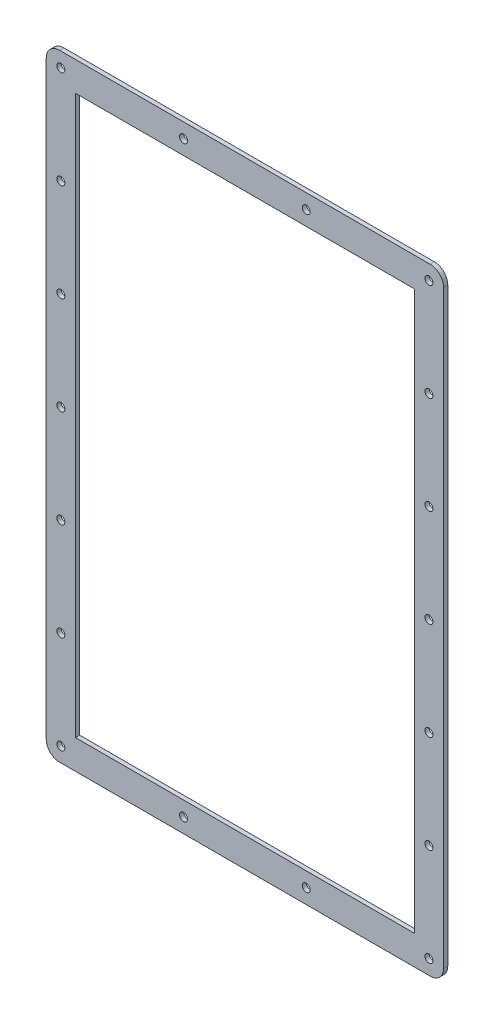
from build123d import *

# Parameters (mm, degrees)
SKETCH1_R           = 3
SKETCH1_W           = 255
SKETCH1_H           = 420
BOSS_EXTRUDE1_DEPTH = 3.175


with BuildPart() as part:
    # Sketch1 → Boss-Extrude1 (new body)
    with BuildSketch(Plane.XY):
        with BuildLine():
            Line((139.5, 232), (-139.5, 232))
            ThreePointArc((-139.5, 232), (-146.571067812, 229.071067812), (-149.5, 222))
            Line((-149.5, 222), (-149.5, -222))
            ThreePointArc((-149.5, -222), (-146.571067812, -229.071067812), (-139.5, -232))
            Line((-139.5, -232), (139.5, -232))
            ThreePointArc((139.5, -232), (146.571067812, -229.071067812), (149.5, -222))
            Line((149.5, -222), (149.5, 222))
            ThreePointArc((149.5, 222), (146.571067812, 229.071067812), (139.5, 232))
        make_face()
        with Locations((138.5, -221)):
            Circle(SKETCH1_R, mode=Mode.SUBTRACT)
        with Locations((46.166666667, -221)):
            Circle(SKETCH1_R, mode=Mode.SUBTRACT)
        with Locations((-46.166666667, -221)):
            Circle(SKETCH1_R, mode=Mode.SUBTRACT)
        with Locations((-138.5, -221)):
            Circle(SKETCH1_R, mode=Mode.SUBTRACT)
        with Locations((-138.5, -73.666666667)):
            Circle(SKETCH1_R, mode=Mode.SUBTRACT)
        with Locations((-138.5, 0)):
            Circle(SKETCH1_R, mode=Mode.SUBTRACT)
        with Locations((138.5, -73.666666667)):
            Circle(SKETCH1_R, mode=Mode.SUBTRACT)
        with Locations((138.5, 0)):
            Circle(SKETCH1_R, mode=Mode.SUBTRACT)
        with Locations((138.5, 73.666666667)):
            Circle(SKETCH1_R, mode=Mode.SUBTRACT)
        with Locations((138.5, 147.333333333)):
            Circle(SKETCH1_R, mode=Mode.SUBTRACT)
        with Locations((138.5, 221)):
            Circle(SKETCH1_R, mode=Mode.SUBTRACT)
        with Locations((46.166666667, 221)):
            Circle(SKETCH1_R, mode=Mode.SUBTRACT)
        with Locations((-138.5, 73.666666667)):
            Circle(SKETCH1_R, mode=Mode.SUBTRACT)
        with Locations((-138.5, 147.333333333)):
            Circle(SKETCH1_R, mode=Mode.SUBTRACT)
        with Locations((-46.166666667, 221)):
            Circle(SKETCH1_R, mode=Mode.SUBTRACT)
        with Locations((-138.5, 221)):
            Circle(SKETCH1_R, mode=Mode.SUBTRACT)
        with Locations((138.5, -147.333333333)):
            Circle(SKETCH1_R, mode=Mode.SUBTRACT)
        with Locations((-138.5, -147.333333333)):
            Circle(SKETCH1_R, mode=Mode.SUBTRACT)
        Rectangle(SKETCH1_W, SKETCH1_H, mode=Mode.SUBTRACT)
    extrude(amount=BOSS_EXTRUDE1_DEPTH)


solid = part.part
